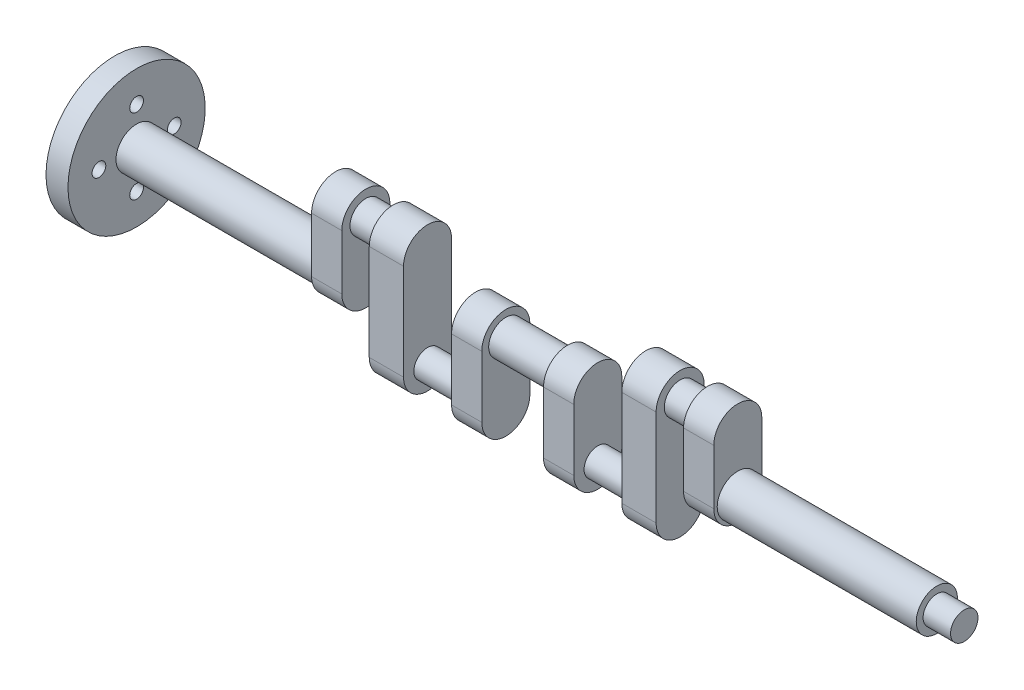
from build123d import *

# Parameters (mm, degrees)
SKETCH1_R            = 10
BOSS_EXTRUDE1_DEPTH  = 20
SKETCH2_R            = 15
BOSS_EXTRUDE2_DEPTH  = 145
BOSS_EXTRUDE3_DEPTH  = 22
SKETCH4_R            = 11.540024106
BOSS_EXTRUDE4_DEPTH  = 20
BOSS_EXTRUDE7_DEPTH  = 25
SKETCH6_R            = 10
BOSS_EXTRUDE8_DEPTH  = 35
BOSS_EXTRUDE11_DEPTH = 22
SKETCH8_R            = 12.5
BOSS_EXTRUDE12_DEPTH = 22.5
SKETCH9_R            = 50
SKETCH9_R_2          = 5
BOSS_EXTRUDE13_DEPTH = 16


with BuildPart() as part:
    # Sketch1 → Boss-Extrude1 (new body)
    with BuildSketch(Plane(origin=(0, 0, 0), x_dir=(0, 0, -1), z_dir=(1, 0, 0))):
        Circle(SKETCH1_R)
    extrude(amount=-BOSS_EXTRUDE1_DEPTH)

    # Sketch2 → Boss-Extrude2 (add)
    with BuildSketch(Plane.ZY.offset(20)):
        Circle(SKETCH2_R)
    boss_extrude2 = extrude(amount=BOSS_EXTRUDE2_DEPTH)

    # Sketch3 → Boss-Extrude3 (add)
    with BuildSketch(Plane.ZY.offset(165)):
        with BuildLine():
            Line((-17.5, 40), (-17.5, 0))
            ThreePointArc((-17.5, 0), (0, -17.5), (17.5, 0))
            Line((17.5, 0), (17.5, 40))
            ThreePointArc((17.5, 40), (0, 57.5), (-17.5, 40))
        make_face()
    boss_extrude3 = extrude(amount=BOSS_EXTRUDE3_DEPTH)

    # Sketch4 → Boss-Extrude4 (add)
    with BuildSketch(Plane.ZY.offset(187)):
        with Locations((0, 40)):
            Circle(SKETCH4_R)
    boss_extrude4 = extrude(amount=BOSS_EXTRUDE4_DEPTH)

    # Sketch5 → Boss-Extrude7 (add)
    with BuildSketch(Plane.ZY.offset(207)):
        with BuildLine():
            Line((-17.5, 40), (-17.5, -30))
            ThreePointArc((-17.5, -30), (0, -47.5), (17.5, -30))
            Line((17.5, -30), (17.5, 40))
            ThreePointArc((17.5, 40), (0, 57.5), (-17.5, 40))
        make_face()
    boss_extrude7 = extrude(amount=BOSS_EXTRUDE7_DEPTH)

    # Sketch6 → Boss-Extrude8 (add)
    with BuildSketch(Plane.ZY.offset(232)):
        with Locations((0, -30)):
            Circle(SKETCH6_R)
    boss_extrude8 = extrude(amount=BOSS_EXTRUDE8_DEPTH)

    # Sketch7 → Boss-Extrude11 (add)
    with BuildSketch(Plane.ZY.offset(267)):
        with BuildLine():
            Line((17.499097446, 14.822268204), (17.5, -30))
            ThreePointArc((17.5, -30), (0, -47.5), (-17.5, -30))
            Line((-17.5, -30), (-17.5, 15))
            ThreePointArc((-17.5, 15), (0.088867044, 32.49977436), (17.499097446, 14.822268204))
        make_face()
    boss_extrude11 = extrude(amount=BOSS_EXTRUDE11_DEPTH)

    # Sketch8 → Boss-Extrude12 (add)
    with BuildSketch(Plane.ZY.offset(289)):
        with Locations(Location((0, 15, 0), (0, 0, 180))):
            Circle(SKETCH8_R)
    boss_extrude12 = extrude(amount=BOSS_EXTRUDE12_DEPTH)

    # Mirror5: Boss-Extrude12 across plane
    add(boss_extrude12.mirror(Plane(origin=(-311.5, 15, 0), x_dir=(0, 0, 1), z_dir=(-1, 0, 0))))

    # Mirror6: Boss-Extrude11 across plane
    add(boss_extrude11.mirror(Plane.ZY.offset(311.5)))

    # Mirror7: Boss-Extrude8 across plane
    add(boss_extrude8.mirror(Plane.ZY.offset(311.5)))

    # Mirror8: Boss-Extrude7 across plane
    add(boss_extrude7.mirror(Plane.ZY.offset(311.5)))

    # Mirror9: Boss-Extrude4 across plane
    add(boss_extrude4.mirror(Plane.ZY.offset(311.5)))

    # Mirror10: Boss-Extrude3 across plane
    add(boss_extrude3.mirror(Plane.ZY.offset(311.5)))

    # Mirror11: Boss-Extrude2 across plane
    add(boss_extrude2.mirror(Plane.ZY.offset(311.5)))

    # Sketch9 → Boss-Extrude13 (add)
    with BuildSketch(Plane.ZY.offset(603)):
        Circle(SKETCH9_R)
        with Locations((0, 27.436873089)):
            Circle(SKETCH9_R_2, mode=Mode.SUBTRACT)
        with Locations((27.436873089, 0)):
            Circle(SKETCH9_R_2, mode=Mode.SUBTRACT)
        with Locations((0, -27.436873089)):
            Circle(SKETCH9_R_2, mode=Mode.SUBTRACT)
        with Locations((-27.436873089, 0)):
            Circle(SKETCH9_R_2, mode=Mode.SUBTRACT)
    extrude(amount=BOSS_EXTRUDE13_DEPTH)


solid = part.part
